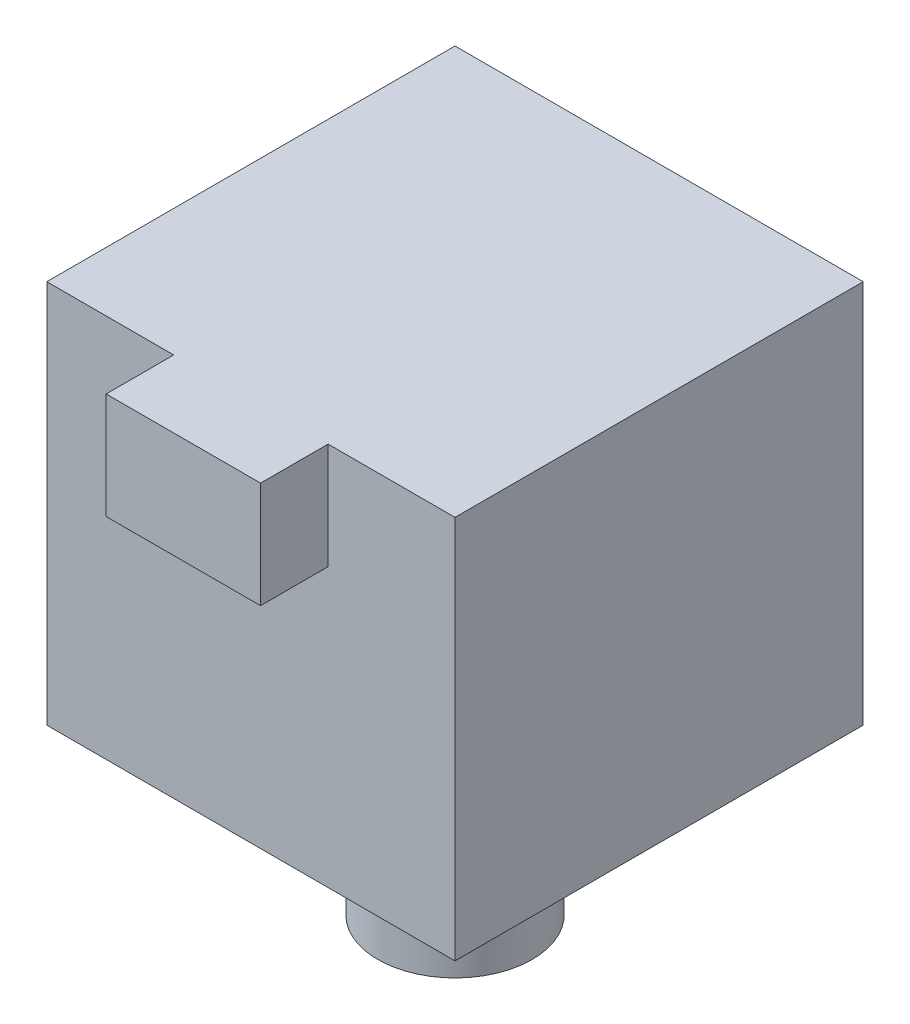
from build123d import *

# Parameters (mm, degrees)
SKETCH2_W           = 42.3
SKETCH2_H           = 42.3
BOSS_EXTRUDE2_DEPTH = 39.8
SKETCH4_R           = 11
BOSS_EXTRUDE3_DEPTH = 2.032
SKETCH6_R           = 1.5
CUT_EXTRUDE1_DEPTH  = 2
SKETCH7_W           = 16
SKETCH7_H           = 11
BOSS_EXTRUDE4_DEPTH = 7
SKETCH9_R           = 2.5
BOSS_EXTRUDE5_DEPTH = 15
BOSS_EXTRUDE7_START = -11
SKETCH11_R          = 8
SKETCH11_R_2        = 2.5
BOSS_EXTRUDE7_DEPTH = 11
SKETCH13_R          = 2.5
BOSS_EXTRUDE8_DEPTH = 0.8


with BuildPart() as part:
    # Sketch2 → Boss-Extrude2 (new body)
    with BuildSketch(Plane(origin=(0, 0, 0), x_dir=(1, 0, 0), z_dir=(0, 1, 0))):
        Rectangle(SKETCH2_W, SKETCH2_H)
    extrude(amount=BOSS_EXTRUDE2_DEPTH)

    # Sketch4 → Boss-Extrude3 (add)
    with BuildSketch(Plane.XZ):
        Circle(SKETCH4_R)
    extrude(amount=BOSS_EXTRUDE3_DEPTH)

    # Sketch6 → Cut-Extrude1 (cut)
    with BuildSketch(Plane.XZ):
        with Locations((15.5, 15.5)):
            Circle(SKETCH6_R)
        with Locations((-15.5, 15.5)):
            Circle(SKETCH6_R)
        with Locations((-15.5, -15.5)):
            Circle(SKETCH6_R)
        with Locations((15.5, -15.5)):
            Circle(SKETCH6_R)
    extrude(amount=-CUT_EXTRUDE1_DEPTH, mode=Mode.SUBTRACT)

    # Sketch7 → Boss-Extrude4 (add)
    with BuildSketch(Plane.XY.offset(21.15)):
        with Locations((0, 34.3)):
            Rectangle(SKETCH7_W, SKETCH7_H)
    extrude(amount=BOSS_EXTRUDE4_DEPTH)

    # Sketch9 → Boss-Extrude5 (add)
    with BuildSketch(Plane.XZ.offset(2.032)):
        Circle(SKETCH9_R)
    extrude(amount=BOSS_EXTRUDE5_DEPTH)

    # Sketch11 → Boss-Extrude7 (add)
    with BuildSketch(Plane.XZ.offset(17.032).offset(BOSS_EXTRUDE7_START)):
        Circle(SKETCH11_R)
        Circle(SKETCH11_R_2, mode=Mode.SUBTRACT)
    extrude(amount=BOSS_EXTRUDE7_DEPTH)

    # Sketch13 → Boss-Extrude8 (add)
    with BuildSketch(Plane.XZ.offset(17.032)):
        Circle(SKETCH13_R)
    extrude(amount=BOSS_EXTRUDE8_DEPTH)


solid = part.part
